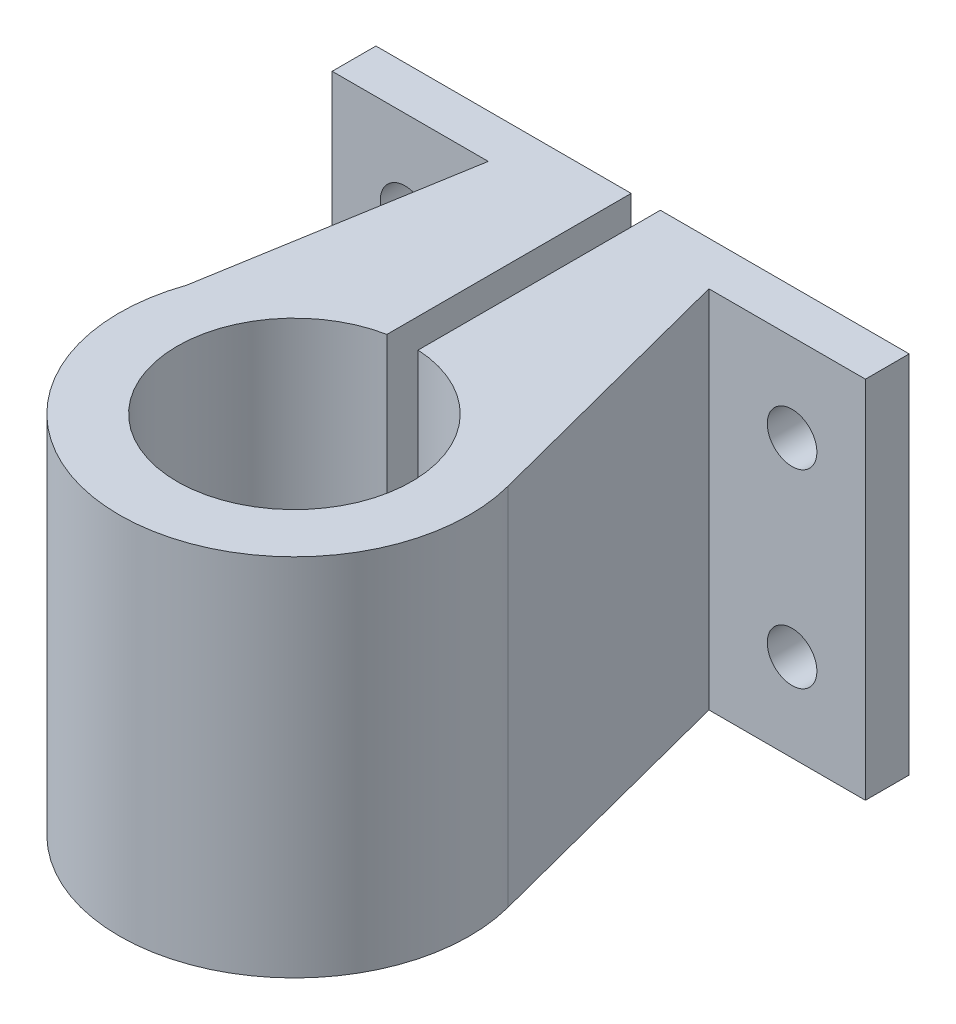
from build123d import *

# Parameters (mm, degrees)
SKETCH1_R           = 1.7
BOSS_EXTRUDE1_DEPTH = 38
CUT_EXTRUDE1_DEPTH  = 38
SKETCH3_R           = 1.7
CUT_EXTRUDE2_DEPTH  = 9


with BuildPart() as part:
    # Sketch1 → Boss-Extrude1 (new body)
    with BuildSketch(Plane.XY):
        Polygon((-194.023766161, 235.92362241), (-230.573766163, 235.92362241), (-230.573766163, 210.92362241), (-194.023766161, 210.92362241), (-194.023766161, 223.42362241), align=None)
        with Locations((-225.573766163, 216.92362241)):
            Circle(SKETCH1_R, mode=Mode.SUBTRACT)
        with Locations((-225.573766163, 229.92362241)):
            Circle(SKETCH1_R, mode=Mode.SUBTRACT)
    extrude(amount=BOSS_EXTRUDE1_DEPTH)

    # Sketch2 → Cut-Extrude1 (cut)
    with BuildSketch(Plane(origin=(0, 235.92362241, 0), x_dir=(1, 0, 0), z_dir=(0, 1, 0))):
        with BuildLine():
            Line((-213.078407846, 0), (-213.078407846, -16.742061243))
            ThreePointArc((-213.078407846, -16.742061243), (-210.979515598, -32.649316271), (-211.078407846, -16.604493694))
            Line((-211.078407846, -16.604493694), (-211.078407846, 0))
            Line((-211.078407846, 0), (-213.078407846, 0))
        make_face()
        with BuildLine():
            ThreePointArc((-199.916412956, -21.613593286), (-212.016456661, -36.620181105), (-222.864018355, -20.684713088))
            Line((-222.864018355, -20.684713088), (-219.873766163, -3))
            Line((-219.873766163, -3), (-230.573766163, -3))
            Line((-230.573766163, -3), (-230.573766163, -38))
            Line((-230.573766163, -38), (-194.023766161, -38))
            Line((-194.023766161, -38), (-194.023766161, -3))
            Line((-194.023766161, -3), (-204.750473292, -3))
            Line((-204.750473292, -3), (-199.916412956, -21.613593286))
        make_face()
    extrude(amount=-CUT_EXTRUDE1_DEPTH, mode=Mode.SUBTRACT)

    # Sketch3 → Cut-Extrude2 (cut)
    with BuildSketch(Plane(origin=(0, 0, 0), x_dir=(-1, 0, 0), z_dir=(0, 0, -1))):
        with Locations((199.050473293, 216.92362241)):
            Circle(SKETCH3_R)
        with Locations((199.050473293, 229.92362241)):
            Circle(SKETCH3_R)
    extrude(amount=-CUT_EXTRUDE2_DEPTH, mode=Mode.SUBTRACT)


solid = part.part
